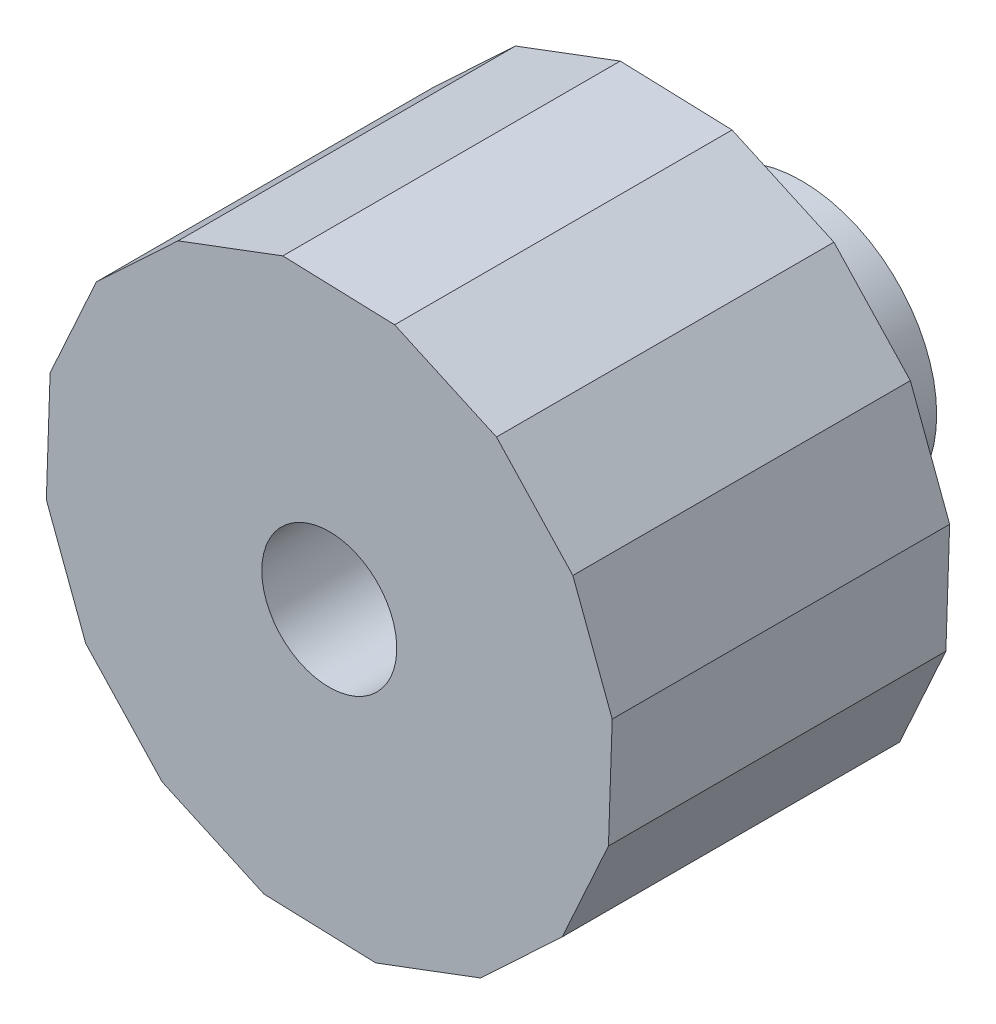
from build123d import *

# Parameters (mm, degrees)
EXTRUDE_1_DEPTH     = 15
SKETCH_2_R          = 6
EXTRUDE_2_DEPTH     = 6
SKETCH_3_R          = 3
CUT_EXTRUDE_1_DEPTH = 28.519640546


with BuildPart() as part:
    # Эскиз1 → Бобышка-Вытянуть1 (new body)
    with BuildSketch(Plane.XY):
        Polygon((10.828570014, 6.721181388), (7.432209439, 10.353476259), (2.90436235, 12.409548224), (-2.065647578, 12.576378965), (-6.721181388, 10.828570014), (-10.353476259, 7.432209439), (-12.409548224, 2.90436235), (-12.576378965, -2.065647578), (-10.828570014, -6.721181388), (-7.432209439, -10.353476259), (-2.90436235, -12.409548224), (2.065647578, -12.576378965), (6.721181388, -10.828570014), (10.353476259, -7.432209439), (12.409548224, -2.90436235), (12.576378965, 2.065647578), align=None)
    extrude(amount=EXTRUDE_1_DEPTH)

    # Эскиз2 → Бобышка-Вытянуть2 (add)
    with BuildSketch(Plane(origin=(0, 0, 0), x_dir=(-1, 0, 0), z_dir=(0, 0, -1))):
        with Locations(Location((0, 0, 0), (0, 0, 180))):
            Circle(SKETCH_2_R)
    extrude(amount=EXTRUDE_2_DEPTH)

    # Эскиз3 → Вырез-Вытянуть1 (cut, through all)
    with BuildSketch(Plane(origin=(0, 0, -6), x_dir=(-1, 0, 0), z_dir=(0, 0, -1))):
        Circle(SKETCH_3_R)
    extrude(amount=-CUT_EXTRUDE_1_DEPTH, mode=Mode.SUBTRACT)


solid = part.part
